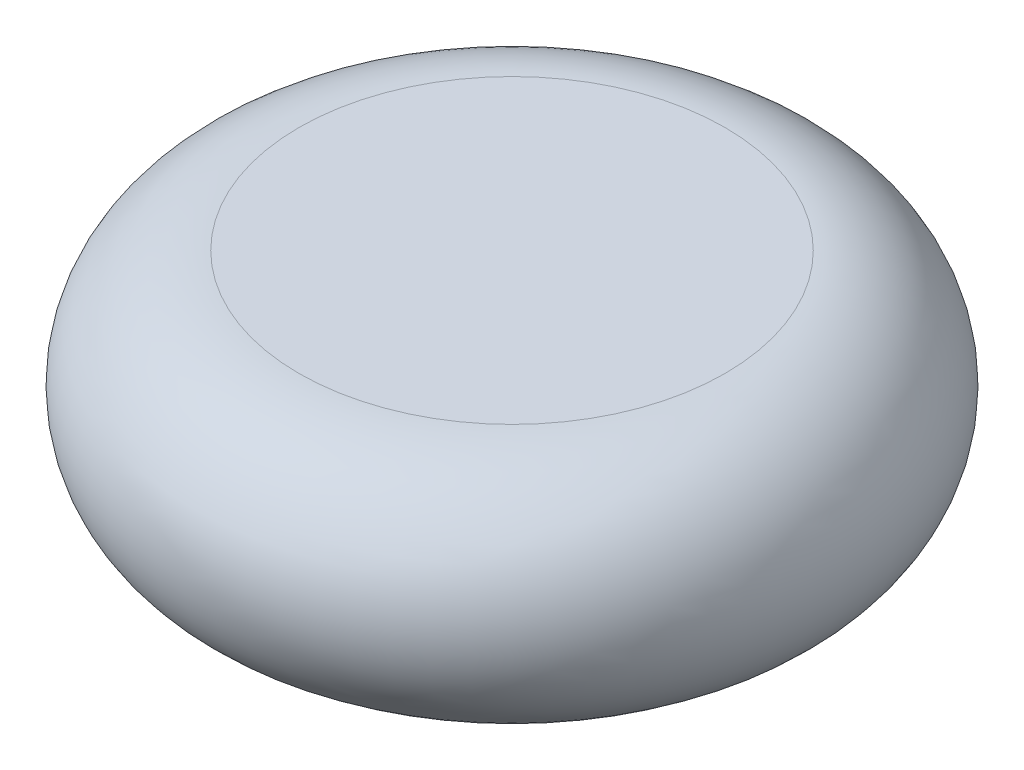
from build123d import *

# Parameters (mm, degrees)
SKETCH1_R           = 228.6
BOSS_EXTRUDE1_DEPTH = 250


with BuildPart() as part:
    # Sketch1 → Boss-Extrude1 (new body)
    with BuildSketch(Plane(origin=(0, 0, 0), x_dir=(1, 0, 0), z_dir=(0, 1, 0))):
        with Locations(Location((0, 0, 0), (0, 0, 270))):
            Circle(SKETCH1_R)
    extrude(amount=BOSS_EXTRUDE1_DEPTH)

    # Sketch2 → Revolve1 (revolve)
    with BuildSketch(Plane.XY, mode=Mode.PRIVATE) as revolve1_sk:
        with BuildLine():
            Line((228.6, 250), (228.6, 0))
            ThreePointArc((228.6, 0), (353.6, 125), (228.6, 250))
        make_face()
    revolve(revolve1_sk.sketch.rotate(Axis((0, 445.310887901, 0), (0, -1, 0)), 90), axis=Axis((0, 445.310887901, 0), (0, -1, 0)))


solid = part.part
